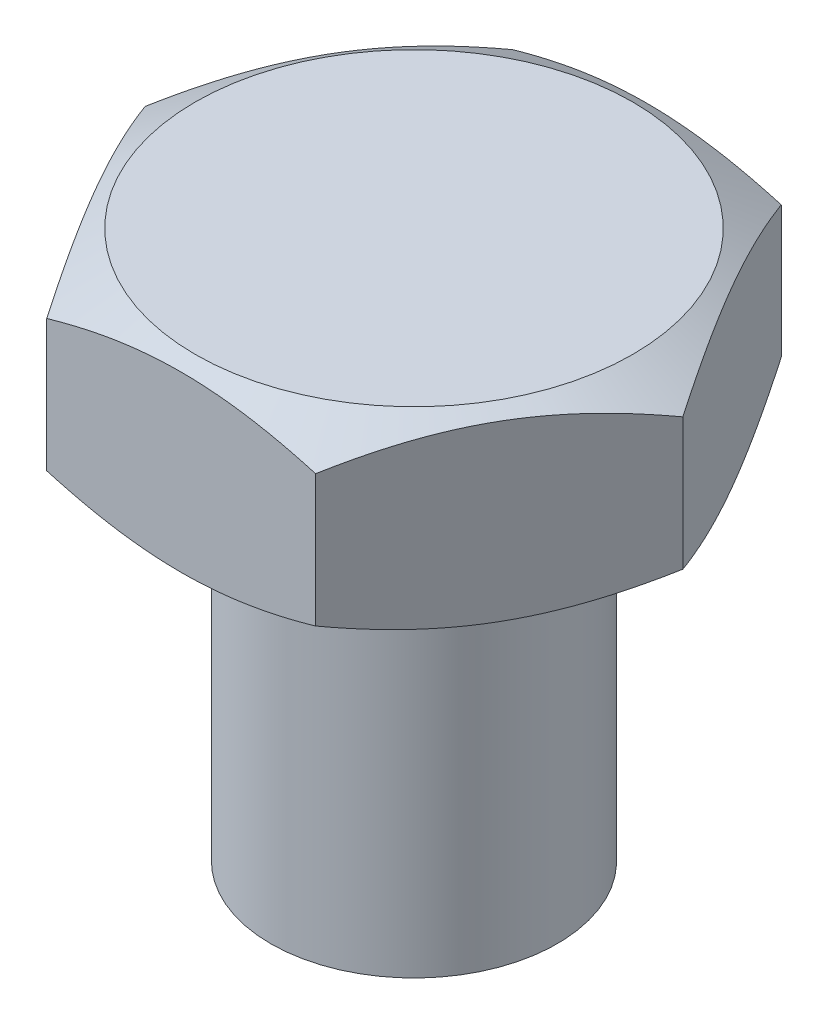
from build123d import *

# Parameters (mm, degrees)
EXTRUDE1_DEPTH = 5.3
SKETCH2_R      = 4
EXTRUDE2_DEPTH = 10


with BuildPart() as part:
    # Sketch1 → Extrude1 (new body)
    with BuildSketch(Plane(origin=(0, 0, 0), x_dir=(1, 0, 0), z_dir=(0, 1, 0))):
        Polygon((7.505553499, 0), (3.75277675, 6.5), (-3.75277675, 6.5), (-7.505553499, 0), (-3.75277675, -6.5), (3.75277675, -6.5), align=None)
    extrude(amount=-EXTRUDE1_DEPTH)

    # Sketch2 → Extrude2 (add)
    with BuildSketch(Plane.XZ.offset(5.3)):
        with Locations(Location((0, 0, 0), (0, 0, 270))):
            Circle(SKETCH2_R)
    extrude(amount=EXTRUDE2_DEPTH)

    # Sketch3 → Cut-Revolve1 (revolve, cut)
    with BuildSketch(Plane.XY):
        Polygon((6.105553499, 0), (7.505553499, 0), (7.505553499, -0.808290377), align=None)
        Polygon((7.505553499, -5.3), (7.505553499, -4.491709623), (6.105553499, -5.3), align=None)
    revolve(axis=Axis((0, -1000, 0), (0, 1, 0)), mode=Mode.SUBTRACT)


solid = part.part
